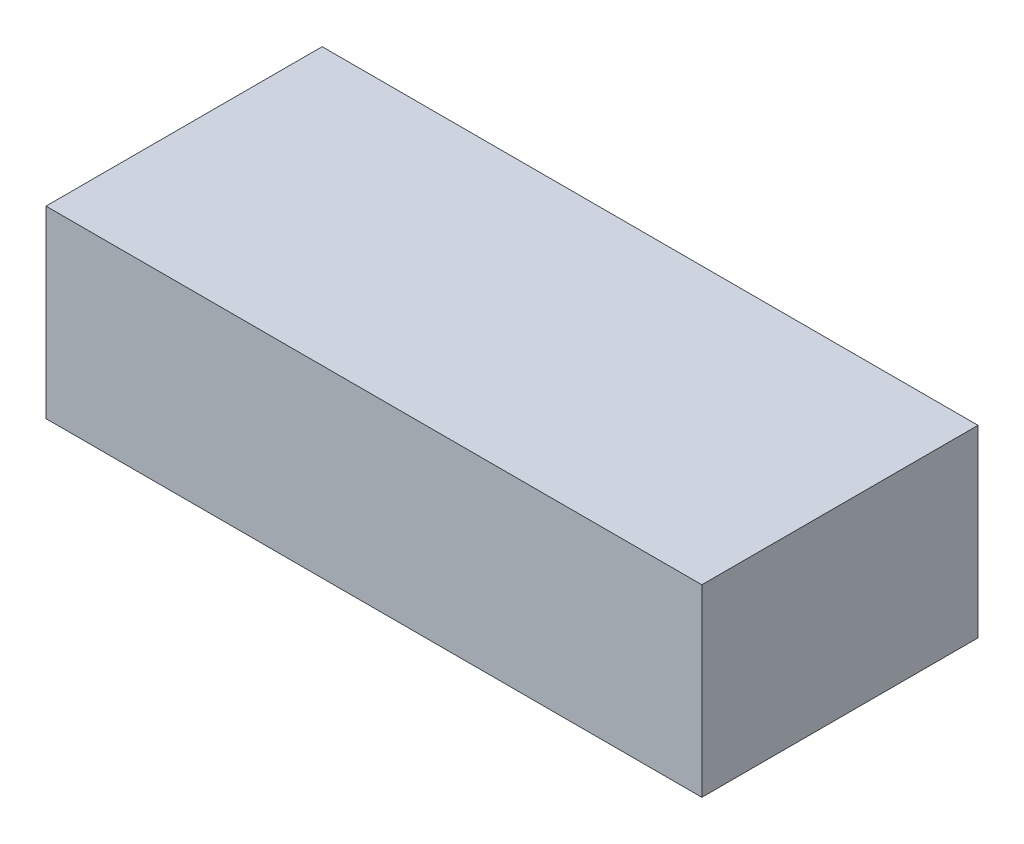
from build123d import *

# Parameters (mm, degrees)
SKETCH1_W           = 361.95
SKETCH1_H           = 152.4
BOSS_EXTRUDE1_DEPTH = 101.6


with BuildPart() as part:
    # Sketch1 → Boss-Extrude1 (new body)
    with BuildSketch(Plane(origin=(0, 0, 0), x_dir=(1, 0, 0), z_dir=(0, 1, 0))):
        with Locations((180.975, 76.2)):
            Rectangle(SKETCH1_W, SKETCH1_H)
    extrude(amount=BOSS_EXTRUDE1_DEPTH)


solid = part.part
